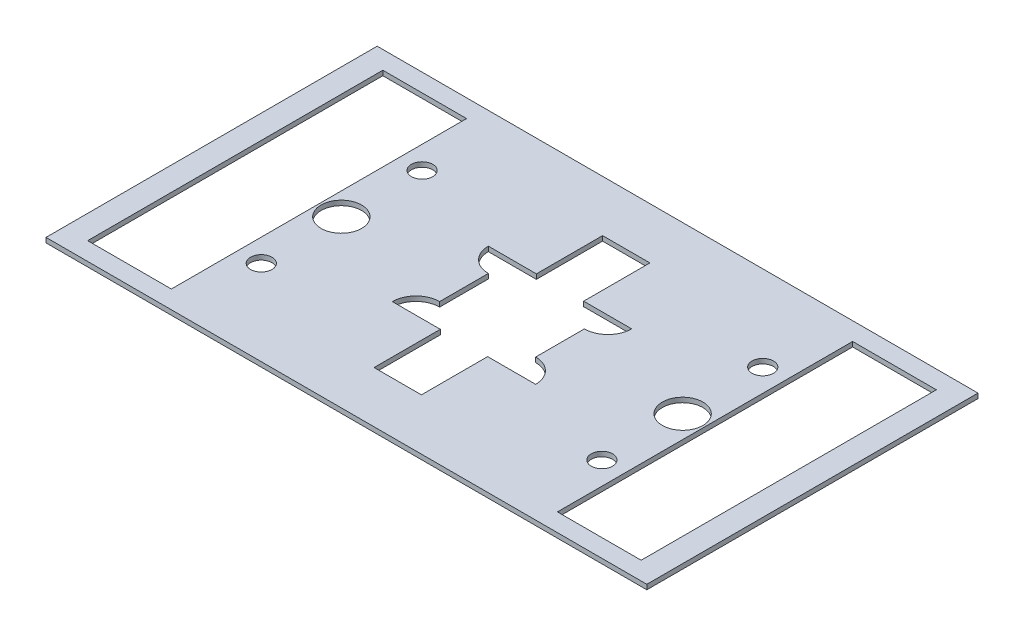
from build123d import *

# Parameters (mm, degrees)
SKETCH1_W           = 63.5
SKETCH1_H           = 35
SKETCH1_R           = 1.13
SKETCH1_W_2         = 8.85
SKETCH1_H_2         = 31.2
SKETCH1_R_2         = 2.144603346
BOSS_EXTRUDE1_DEPTH = 0.508


with BuildPart() as part:
    # Sketch1 → Boss-Extrude1 (new body)
    with BuildSketch(Plane(origin=(0, 0, 0), x_dir=(1, 0, 0), z_dir=(0, 1, 0))):
        Rectangle(SKETCH1_W, SKETCH1_H)
        with BuildLine():
            Line((-2.5, 5.075), (-2.5, 12.075))
            Line((-2.5, 12.075), (2.5, 12.075))
            Line((2.5, 12.075), (2.5, 5.075))
            Line((2.5, 5.075), (7.575, 5.075))
            ThreePointArc((7.575, 5.075), (6.842766953, 3.307233047), (5.075, 2.575))
            Line((5.075, 2.575), (5.075, -2.575))
            ThreePointArc((5.075, -2.575), (6.842766953, -3.307233047), (7.575, -5.075))
            Line((7.575, -5.075), (2.5, -5.075))
            Line((2.5, -5.075), (2.5, -12.075))
            Line((2.5, -12.075), (-2.5, -12.075))
            Line((-2.5, -12.075), (-2.5, -5.075))
            Line((-2.5, -5.075), (-7.575, -5.075))
            ThreePointArc((-7.575, -5.075), (-6.842766953, -3.307233047), (-5.075, -2.575))
            Line((-5.075, -2.575), (-5.075, 2.575))
            ThreePointArc((-5.075, 2.575), (-6.842766953, 3.307233047), (-7.575, 5.075))
            Line((-7.575, 5.075), (-2.5, 5.075))
        make_face(mode=Mode.SUBTRACT)
        with Locations(Location((-18, -8.5, 0), (0, 0, 270))):
            Circle(SKETCH1_R, mode=Mode.SUBTRACT)
        with Locations(Location((18, -8.5, 0), (0, 0, 270))):
            Circle(SKETCH1_R, mode=Mode.SUBTRACT)
        with Locations((-24.825, 0)):
            Rectangle(SKETCH1_W_2, SKETCH1_H_2, mode=Mode.SUBTRACT)
        with Locations(Location((-18.034, 0, 0), (0, 0, 270))):
            Circle(SKETCH1_R_2, mode=Mode.SUBTRACT)
        with Locations(Location((-18, 8.5, 0), (0, 0, 270))):
            Circle(SKETCH1_R, mode=Mode.SUBTRACT)
        with Locations(Location((18, 8.5, 0), (0, 0, 270))):
            Circle(SKETCH1_R, mode=Mode.SUBTRACT)
        with Locations((24.825, 0)):
            Rectangle(SKETCH1_W_2, SKETCH1_H_2, mode=Mode.SUBTRACT)
        with Locations(Location((18.034, 0, 0), (0, 0, 270))):
            Circle(SKETCH1_R_2, mode=Mode.SUBTRACT)
    extrude(amount=BOSS_EXTRUDE1_DEPTH)


solid = part.part
